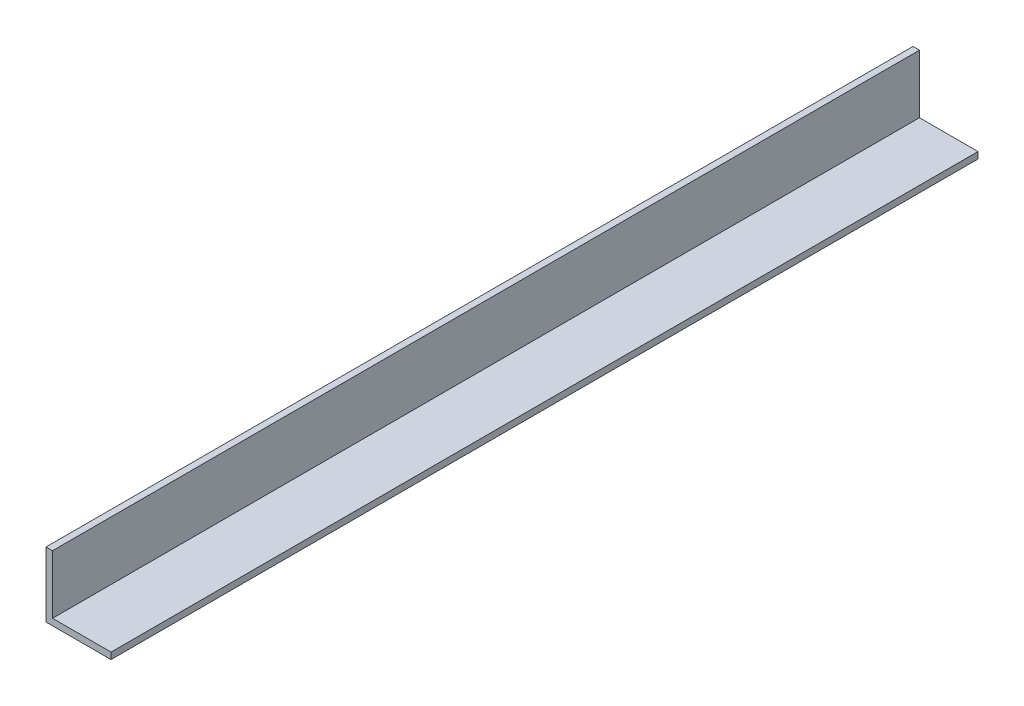
from build123d import *

# Parameters (mm, degrees)
ESTRUSIONE_ESTRUSIONE1_DEPTH = 400


with BuildPart() as part:
    # Schizzo1 → Estrusione-Estrusione1 (new body)
    with BuildSketch(Plane.XY):
        Polygon((0, 30), (0, 0), (30, 0), (30, 3), (3, 3), (3, 30), align=None)
    extrude(amount=ESTRUSIONE_ESTRUSIONE1_DEPTH)


solid = part.part
